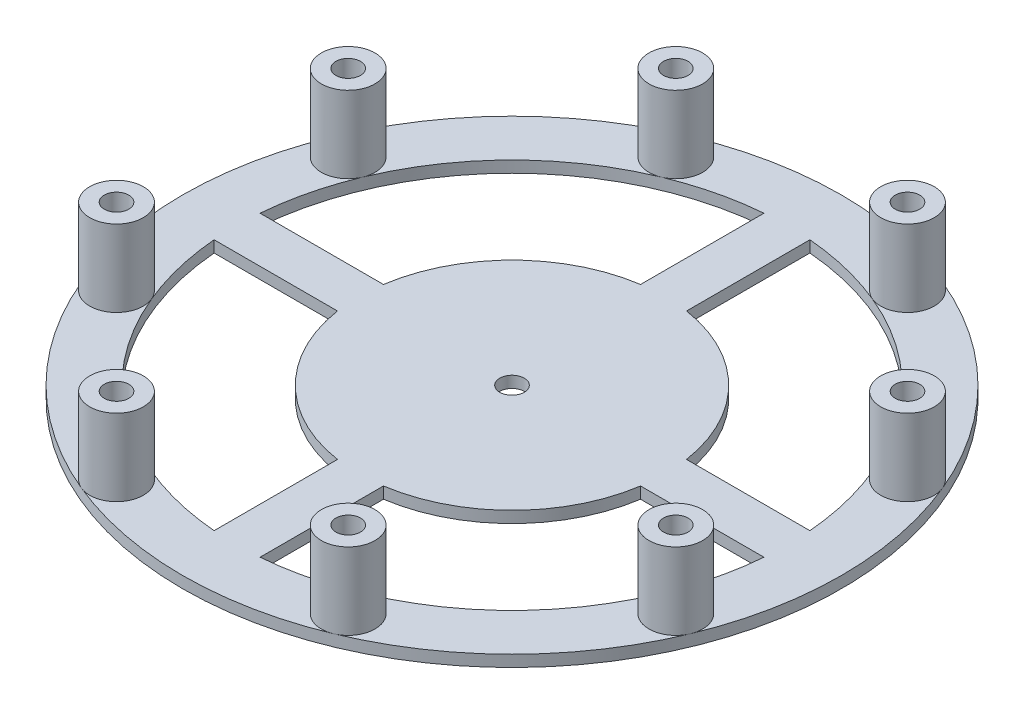
from build123d import *

# Parameters (mm, degrees)
ESBO_O1_R                = 43
ESBO_O1_R_2              = 1.6
RESSALTO_EXTRUS_O1_DEPTH = 0.75
ESBO_O2_R                = 3.5
ESBO_O2_R_2              = 1.6
RESSALTO_EXTRUS_O3_DEPTH = 10


with BuildPart() as part:
    # Esboço1 → Ressalto-extrusão1 (new, symmetric)
    with BuildSketch(Plane(origin=(0, 0, 0), x_dir=(1, 0, 0), z_dir=(0, 1, 0))):
        with Locations(Location((0, 0, 0), (0, 0, 270))):
            Circle(ESBO_O1_R)
        with Locations(Location((-36.493241534, 15.115995578, 0), (0, 0, 270))):
            Circle(ESBO_O1_R_2, mode=Mode.SUBTRACT)
        with Locations(Location((-15.115995578, 36.493241534, 0), (0, 0, 270))):
            Circle(ESBO_O1_R_2, mode=Mode.SUBTRACT)
        with Locations(Location((15.115995578, 36.493241534, 0), (0, 0, 270))):
            Circle(ESBO_O1_R_2, mode=Mode.SUBTRACT)
        with Locations(Location((36.493241534, 15.115995578, 0), (0, 0, 270))):
            Circle(ESBO_O1_R_2, mode=Mode.SUBTRACT)
        with Locations(Location((36.493241534, -15.115995578, 0), (0, 0, 270))):
            Circle(ESBO_O1_R_2, mode=Mode.SUBTRACT)
        with Locations(Location((15.115995578, -36.493241534, 0), (0, 0, 270))):
            Circle(ESBO_O1_R_2, mode=Mode.SUBTRACT)
        with Locations(Location((-15.115995578, -36.493241534, 0), (0, 0, 270))):
            Circle(ESBO_O1_R_2, mode=Mode.SUBTRACT)
        with Locations(Location((-36.493241534, -15.115995578, 0), (0, 0, 270))):
            Circle(ESBO_O1_R_2, mode=Mode.SUBTRACT)
        with Locations(Location((0, 0, 0), (0, 0, 270))):
            Circle(ESBO_O1_R_2, mode=Mode.SUBTRACT)
        with BuildLine():
            Line((-3, 19.773719933), (-3, 35.874782229))
            ThreePointArc((-3, 35.874782229), (-25.455844123, 25.455844123), (-35.874782229, 3))
            Line((-35.874782229, 3), (-19.773719933, 3))
            ThreePointArc((-19.773719933, 3), (-14.142135624, 14.142135624), (-3, 19.773719933))
        make_face(mode=Mode.SUBTRACT)
        with BuildLine():
            Line((3, 19.773719933), (3, 35.874782229))
            ThreePointArc((3, 35.874782229), (25.455844123, 25.455844123), (35.874782229, 3))
            Line((35.874782229, 3), (19.773719933, 3))
            ThreePointArc((19.773719933, 3), (14.142135624, 14.142135624), (3, 19.773719933))
        make_face(mode=Mode.SUBTRACT)
        with BuildLine():
            Line((19.773719933, -3), (35.874782229, -3))
            ThreePointArc((35.874782229, -3), (25.455844123, -25.455844123), (3, -35.874782229))
            Line((3, -35.874782229), (3, -19.773719933))
            ThreePointArc((3, -19.773719933), (14.142135624, -14.142135624), (19.773719933, -3))
        make_face(mode=Mode.SUBTRACT)
        with BuildLine():
            Line((-3, -19.773719933), (-3, -35.874782229))
            ThreePointArc((-3, -35.874782229), (-25.455844123, -25.455844123), (-35.874782229, -3))
            Line((-35.874782229, -3), (-19.773719933, -3))
            ThreePointArc((-19.773719933, -3), (-14.142135624, -14.142135624), (-3, -19.773719933))
        make_face(mode=Mode.SUBTRACT)
    extrude(amount=RESSALTO_EXTRUS_O1_DEPTH, both=True)

    # Esboço2 → Ressalto-extrusão3 (add)
    # profile 1 of 8: a face of its own
    with BuildSketch(Plane(origin=(0, 0.75, 0), x_dir=(1, 0, 0), z_dir=(0, 1, 0))):
        with Locations(Location((-15.115995578, 36.493241534, 0), (0, 0, 112.5))):
            Circle(ESBO_O2_R)
        with Locations(Location((-15.115995578, 36.493241534, 0), (0, 0, 270))):
            Circle(ESBO_O2_R_2, mode=Mode.SUBTRACT)
    # profile 2 of 8: a face of its own
    with BuildSketch(Plane(origin=(0, 0.75, 0), x_dir=(1, 0, 0), z_dir=(0, 1, 0))):
        with Locations(Location((15.115995578, 36.493241534, 0), (0, 0, 67.5))):
            Circle(ESBO_O2_R)
        with Locations(Location((15.115995578, 36.493241534, 0), (0, 0, 270))):
            Circle(ESBO_O2_R_2, mode=Mode.SUBTRACT)
    # profile 3 of 8: a face of its own
    with BuildSketch(Plane(origin=(0, 0.75, 0), x_dir=(1, 0, 0), z_dir=(0, 1, 0))):
        with Locations(Location((36.493241534, 15.115995578, 0), (0, 0, 22.5))):
            Circle(ESBO_O2_R)
        with Locations(Location((36.493241534, 15.115995578, 0), (0, 0, 270))):
            Circle(ESBO_O2_R_2, mode=Mode.SUBTRACT)
    # profile 4 of 8: a face of its own
    with BuildSketch(Plane(origin=(0, 0.75, 0), x_dir=(1, 0, 0), z_dir=(0, 1, 0))):
        with Locations(Location((36.493241534, -15.115995578, 0), (0, 0, 157.5))):
            Circle(ESBO_O2_R)
        with Locations(Location((36.493241534, -15.115995578, 0), (0, 0, 270))):
            Circle(ESBO_O2_R_2, mode=Mode.SUBTRACT)
    # profile 5 of 8: a face of its own
    with BuildSketch(Plane(origin=(0, 0.75, 0), x_dir=(1, 0, 0), z_dir=(0, 1, 0))):
        with Locations(Location((15.115995578, -36.493241534, 0), (0, 0, 112.5))):
            Circle(ESBO_O2_R)
        with Locations(Location((15.115995578, -36.493241534, 0), (0, 0, 270))):
            Circle(ESBO_O2_R_2, mode=Mode.SUBTRACT)
    # profile 6 of 8: a face of its own
    with BuildSketch(Plane(origin=(0, 0.75, 0), x_dir=(1, 0, 0), z_dir=(0, 1, 0))):
        with Locations(Location((-15.115995578, -36.493241534, 0), (0, 0, 67.5))):
            Circle(ESBO_O2_R)
        with Locations(Location((-15.115995578, -36.493241534, 0), (0, 0, 270))):
            Circle(ESBO_O2_R_2, mode=Mode.SUBTRACT)
    # profile 7 of 8: a face of its own
    with BuildSketch(Plane(origin=(0, 0.75, 0), x_dir=(1, 0, 0), z_dir=(0, 1, 0))):
        with Locations(Location((-36.493241534, -15.115995578, 0), (0, 0, 22.5))):
            Circle(ESBO_O2_R)
        with Locations(Location((-36.493241534, -15.115995578, 0), (0, 0, 270))):
            Circle(ESBO_O2_R_2, mode=Mode.SUBTRACT)
    # profile 8 of 8: a face of its own
    with BuildSketch(Plane(origin=(0, 0.75, 0), x_dir=(1, 0, 0), z_dir=(0, 1, 0))):
        with Locations(Location((-36.493241534, 15.115995578, 0), (0, 0, 157.5))):
            Circle(ESBO_O2_R)
        with Locations(Location((-36.493241534, 15.115995578, 0), (0, 0, 270))):
            Circle(ESBO_O2_R_2, mode=Mode.SUBTRACT)
    extrude(amount=RESSALTO_EXTRUS_O3_DEPTH)


solid = part.part
